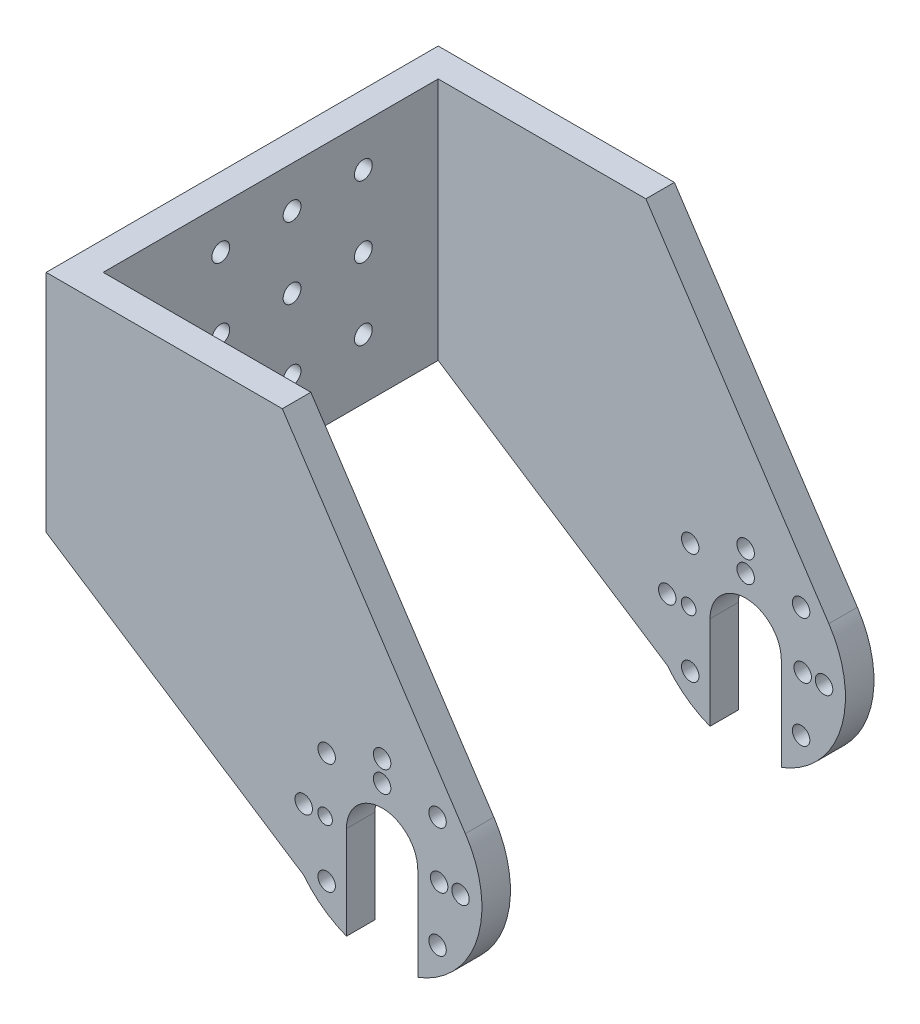
from build123d import *

# Parameters (mm, degrees)
SKETCH_1_R          = 5
SKETCH_1_R_2        = 1.225
SKETCH_1_R_3        = 1.025
EXTRUDE_1_DEPTH     = 55
SKETCH_2_W          = 57.132931415
SKETCH_2_H          = 47
CUT_EXTRUDE_1_DEPTH = 66
SKETCH_3_R          = 1.25
CUT_EXTRUDE_2_DEPTH = 49
CUT_EXTRUDE_START   = -56
CUT_EXTRUDE_3_DEPTH = 56


with BuildPart() as part:
    # 스케치1 → 보스-돌출1 (new body)
    with BuildSketch(Plane.XY):
        with BuildLine():
            Line((11.674013781, 7.727703555), (-14, 46.512678751))
            Line((-14, 46.512678751), (-47.132931415, 46.512678751))
            Line((-47.132931415, 46.512678751), (-47.132931415, 14.921692086))
            Line((-47.132931415, 14.921692086), (-11, -8.660254038))
            ThreePointArc((-11, -8.660254038), (8.200906179, -11.346591463), (11.674013781, 7.727703555))
        make_face()
        Circle(SKETCH_1_R, mode=Mode.SUBTRACT)
        with Locations((0, 8)):
            Circle(SKETCH_1_R_2, mode=Mode.SUBTRACT)
        with Locations((0, 11)):
            Circle(SKETCH_1_R_2, mode=Mode.SUBTRACT)
        with Locations((7.778174593, 7.778174593)):
            Circle(SKETCH_1_R_2, mode=Mode.SUBTRACT)
        with Locations((8, 0)):
            Circle(SKETCH_1_R_2, mode=Mode.SUBTRACT)
        with Locations((11, 0)):
            Circle(SKETCH_1_R_2, mode=Mode.SUBTRACT)
        with Locations((7.778174593, -7.778174593)):
            Circle(SKETCH_1_R_2, mode=Mode.SUBTRACT)
        with Locations((0, -8)):
            Circle(SKETCH_1_R_2, mode=Mode.SUBTRACT)
        with Locations((0, -11)):
            Circle(SKETCH_1_R_2, mode=Mode.SUBTRACT)
        with Locations((-7.778174593, -7.778174593)):
            Circle(SKETCH_1_R_2, mode=Mode.SUBTRACT)
        with Locations((-8, 0)):
            Circle(SKETCH_1_R_3, mode=Mode.SUBTRACT)
        with Locations((-11, 0)):
            Circle(SKETCH_1_R_2, mode=Mode.SUBTRACT)
        with Locations((-7.778174593, 7.778174593)):
            Circle(SKETCH_1_R_2, mode=Mode.SUBTRACT)
    extrude(amount=EXTRUDE_1_DEPTH)

    # 스케치2 → 컷-돌출1 (cut)
    with BuildSketch(Plane(origin=(0, 46.512678751, 0), x_dir=(1, 0, 0), z_dir=(0, 1, 0))):
        with Locations((-14.566465708, -27.5)):
            Rectangle(SKETCH_2_W, SKETCH_2_H)
    extrude(amount=-CUT_EXTRUDE_1_DEPTH, mode=Mode.SUBTRACT)

    # 스케치3 → 컷-돌출2 (cut)
    with BuildSketch(Plane.ZY.offset(47.132931415)):
        with Locations(Location((24.5, 30.717185419, 0), (0, 0, 270))):
            Circle(SKETCH_3_R)
        with Locations(Location((14.5, 40.717185419, 0), (0, 0, 270))):
            Circle(SKETCH_3_R)
        with Locations(Location((34.5, 30.717185419, 0), (0, 0, 270))):
            Circle(SKETCH_3_R)
        with Locations(Location((24.5, 40.717185419, 0), (0, 0, 270))):
            Circle(SKETCH_3_R)
        with Locations(Location((14.5, 30.717185419, 0), (0, 0, 270))):
            Circle(SKETCH_3_R)
        with Locations(Location((34.5, 40.717185419, 0), (0, 0, 270))):
            Circle(SKETCH_3_R)
        with Locations(Location((14.5, 20.717185419, 0), (0, 0, 270))):
            Circle(SKETCH_3_R)
        with Locations(Location((24.5, 20.717185419, 0), (0, 0, 270))):
            Circle(SKETCH_3_R)
        with Locations(Location((34.5, 20.717185419, 0), (0, 0, 270))):
            Circle(SKETCH_3_R)
    extrude(amount=-CUT_EXTRUDE_2_DEPTH, mode=Mode.SUBTRACT)

    # 스케치4 → 컷-돌출3 (cut)
    with BuildSketch(Plane.XY.offset(55).offset(CUT_EXTRUDE_START)):
        with BuildLine():
            Line((-5, 0), (-5, -13.076696831))
            ThreePointArc((-5, -13.076696831), (0, -14), (5, -13.076696831))
            Line((5, -13.076696831), (5, 0))
            Line((5, 0), (-5, 0))
        make_face()
    extrude(amount=CUT_EXTRUDE_3_DEPTH, mode=Mode.SUBTRACT)


solid = part.part
